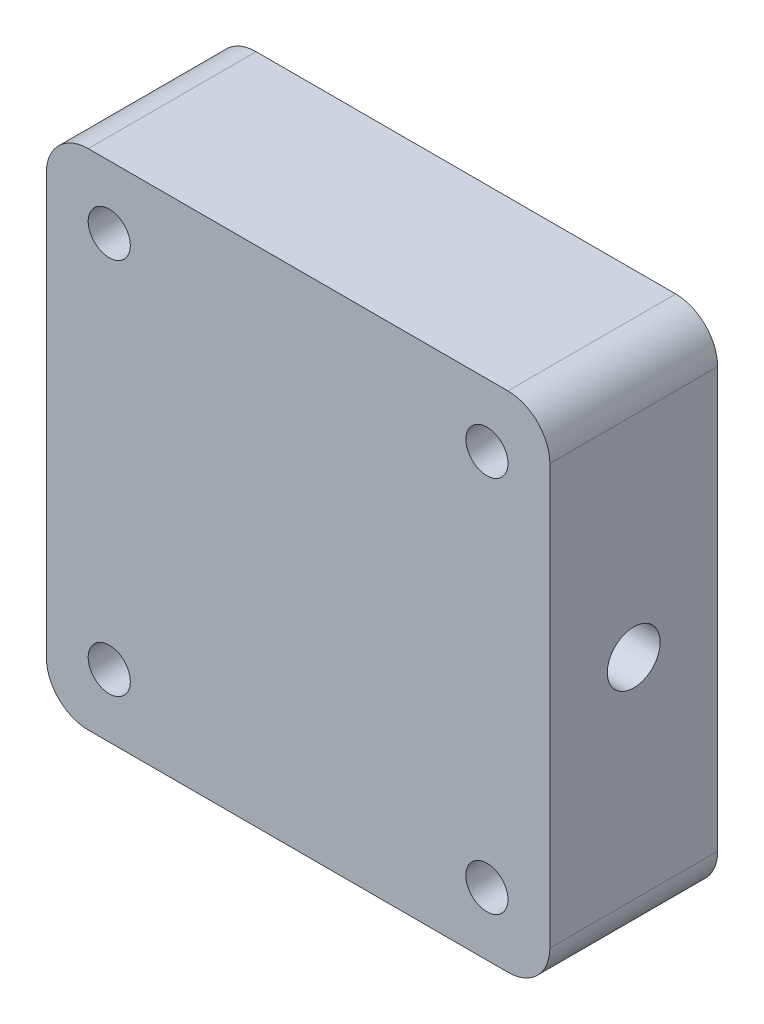
from build123d import *

# Parameters (mm, degrees)
SKETCH1_R           = 3.1877
BOSS_EXTRUDE1_DEPTH = 25.4
SKETCH3_R           = 4
CUT_EXTRUDE1_DEPTH  = 89.9
SCALE1_SCALE        = 0.66


with BuildPart() as part:
    # Sketch1 → Boss-Extrude1 (new body)
    with BuildSketch(Plane.XY):
        with BuildLine():
            Line((-31.75, 38.1), (31.75, 38.1))
            ThreePointArc((31.75, 38.1), (36.240128061, 36.240128061), (38.1, 31.75))
            Line((38.1, 31.75), (38.1, -31.75))
            ThreePointArc((38.1, -31.75), (36.240128061, -36.240128061), (31.75, -38.1))
            Line((31.75, -38.1), (-31.75, -38.1))
            ThreePointArc((-31.75, -38.1), (-36.240128061, -36.240128061), (-38.1, -31.75))
            Line((-38.1, -31.75), (-38.1, 31.75))
            ThreePointArc((-38.1, 31.75), (-36.240128061, 36.240128061), (-31.75, 38.1))
        make_face()
        with Locations((-28.575, 28.575)):
            Circle(SKETCH1_R, mode=Mode.SUBTRACT)
        with Locations((28.575, 28.575)):
            Circle(SKETCH1_R, mode=Mode.SUBTRACT)
        with Locations((28.575, -28.575)):
            Circle(SKETCH1_R, mode=Mode.SUBTRACT)
        with Locations((-28.575, -28.575)):
            Circle(SKETCH1_R, mode=Mode.SUBTRACT)
    extrude(amount=BOSS_EXTRUDE1_DEPTH)

    # Sketch3 → Cut-Extrude1 (cut, through all)
    with BuildSketch(Plane(origin=(38.1, 0, 0), x_dir=(0, 0, -1), z_dir=(1, 0, 0))):
        with Locations((-12.7, 0)):
            Circle(SKETCH3_R)
    extrude(amount=-CUT_EXTRUDE1_DEPTH, mode=Mode.SUBTRACT)


with BuildPart() as part_1:
    # Scale1: scaled about (0, 0, 12.7)
    add(part.part.scale(SCALE1_SCALE).moved(Location((0, 0, 4.318))))


solid = part_1.part
